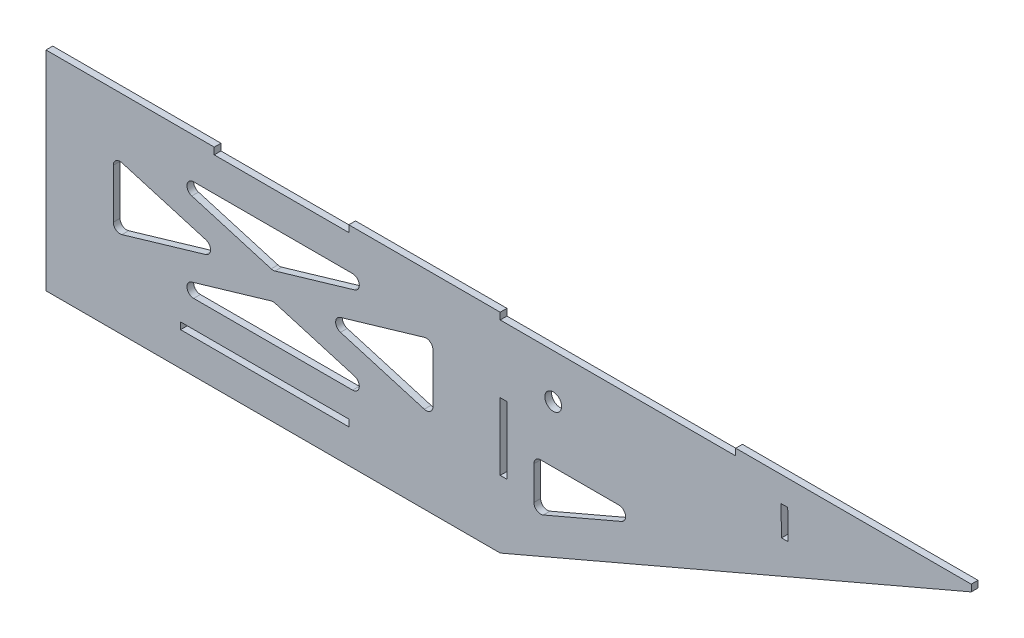
from build123d import *

# Parameters (mm, degrees)
SKETCH_1_W      = 135
SKETCH_1_H      = 60.000000048
SKETCH_1_W_2    = 50
SKETCH_1_H_2    = 2
SKETCH_1_W_3    = 45
SKETCH_1_H_3    = 2.000000262
SKETCH_1_W_4    = 70.000000056
EXTRUDE_1_DEPTH = 2


with BuildPart() as part:
    # 草图1 → 凸台-拉伸1 (new body)
    # profile 1 of 5: a face of its own
    with BuildSketch(Plane.XY):
        with Locations((67.5, -2.86e-07)):
            Rectangle(SKETCH_1_W, SKETCH_1_H)
        with BuildLine():
            ThreePointArc((68.064332648, 0.863431574), (67.5, 0.944700571), (66.935667352, 0.863431574))
            Line((66.935667352, 0.863431574), (43.323685411, -6.081268997))
            ThreePointArc((43.323685411, -6.081268997), (41.908439567, -8.285077177), (43.888018059, -10))
            Line((43.888018059, -10), (91.111981941, -10))
            ThreePointArc((91.111981941, -10), (93.091560433, -8.285077177), (91.676314589, -6.081268997))
            Line((91.676314589, -6.081268997), (68.064332648, 0.863431574))
        make_face(mode=Mode.SUBTRACT)
        with BuildLine():
            ThreePointArc((66.935667352, 9.136568426), (67.5, 9.055299429), (68.064332648, 9.136568426))
            Line((68.064332648, 9.136568426), (91.676314589, 16.081268997))
            ThreePointArc((91.676314589, 16.081268997), (93.091560433, 18.285077177), (91.111981941, 20))
            Line((91.111981941, 20), (43.888018059, 20))
            ThreePointArc((43.888018059, 20), (41.908439567, 18.285077177), (43.323685411, 16.081268997))
            Line((43.323685411, 16.081268997), (66.935667352, 9.136568426))
        make_face(mode=Mode.SUBTRACT)
        with Locations((65, -19)):
            Rectangle(SKETCH_1_W_2, SKETCH_1_H_2, mode=Mode.SUBTRACT)
        with BuildLine():
            Line((47.476314589, 3.081268997), (22.564332648, -4.245784515))
            ThreePointArc((22.564332648, -4.245784515), (20.80180663, -3.928406892), (20, -2.327053512))
            Line((20, -2.327053512), (20, 12.327053512))
            ThreePointArc((20, 12.327053512), (20.80180663, 13.928406892), (22.564332648, 14.245784515))
            Line((22.564332648, 14.245784515), (47.476314589, 6.918731003))
            ThreePointArc((47.476314589, 6.918731003), (48.911981941, 5), (47.476314589, 3.081268997))
        make_face(mode=Mode.SUBTRACT)
        with BuildLine():
            Line((87.523685411, 3.081268997), (112.435667352, -4.245784515))
            ThreePointArc((112.435667352, -4.245784515), (114.19819337, -3.928406892), (115, -2.327053512))
            Line((115, -2.327053512), (115, 12.327053512))
            ThreePointArc((115, 12.327053512), (114.19819337, 13.928406892), (112.435667352, 14.245784515))
            Line((112.435667352, 14.245784515), (87.523685411, 6.918731003))
            ThreePointArc((87.523685411, 6.918731003), (86.088018059, 5), (87.523685411, 3.081268997))
        make_face(mode=Mode.SUBTRACT)
    # profile 2 of 5: a face of its own
    with BuildSketch(Plane.XY):
        Polygon((135, -10), (135, -30.00000031), (275.000000112, 29.999999738), (205.000000056, 29.999999738), (135, 29.999999738), (135, 10), (137, 10), (137, -10), align=None)
        with BuildLine():
            Line((171.04398986, -3.83829006), (147.787838597, -13.80521203))
            ThreePointArc((147.787838597, -13.80521203), (145.899017983, -13.636604154), (145, -11.96692197))
            Line((145, -11.96692197), (145, -2))
            ThreePointArc((145, -2), (145.585786438, -0.585786438), (147, 0))
            Line((147, 0), (170.256151263, 0))
            ThreePointArc((170.256151263, 0), (172.215306708, -1.597868255), (171.04398986, -3.83829006))
        make_face(mode=Mode.SUBTRACT)
        with BuildLine():
            ThreePointArc((153.260493498, 16.868933163), (148.26058869, 16.847116824), (153.260112736, 16.912564179))
            ThreePointArc((153.260112736, 16.912564179), (153.260398305, 16.890749501), (153.260493498, 16.868933163))
        make_face(mode=Mode.SUBTRACT)
        Polygon((218.59660032, 15.692657318), (218.55541264, 18.052297878), (218.443385643, 24.470320233), (220.443081034, 24.505225046), (220.59629571, 15.72756213), align=None, mode=Mode.SUBTRACT)
    # profile 3 of 5: a face of its own
    with BuildSketch(Plane.XY):
        with Locations((112.5, 30.999999869)):
            Rectangle(SKETCH_1_W_3, SKETCH_1_H_3)
    # profile 4 of 5: a face of its own
    with BuildSketch(Plane.XY):
        with Locations((25, 30.999999869)):
            Rectangle(SKETCH_1_W_2, SKETCH_1_H_3)
    # profile 5 of 5: a face of its own
    with BuildSketch(Plane.XY):
        with Locations((240.000000084, 30.999999869)):
            Rectangle(SKETCH_1_W_4, SKETCH_1_H_3)
    extrude(amount=EXTRUDE_1_DEPTH)


solid = part.part
